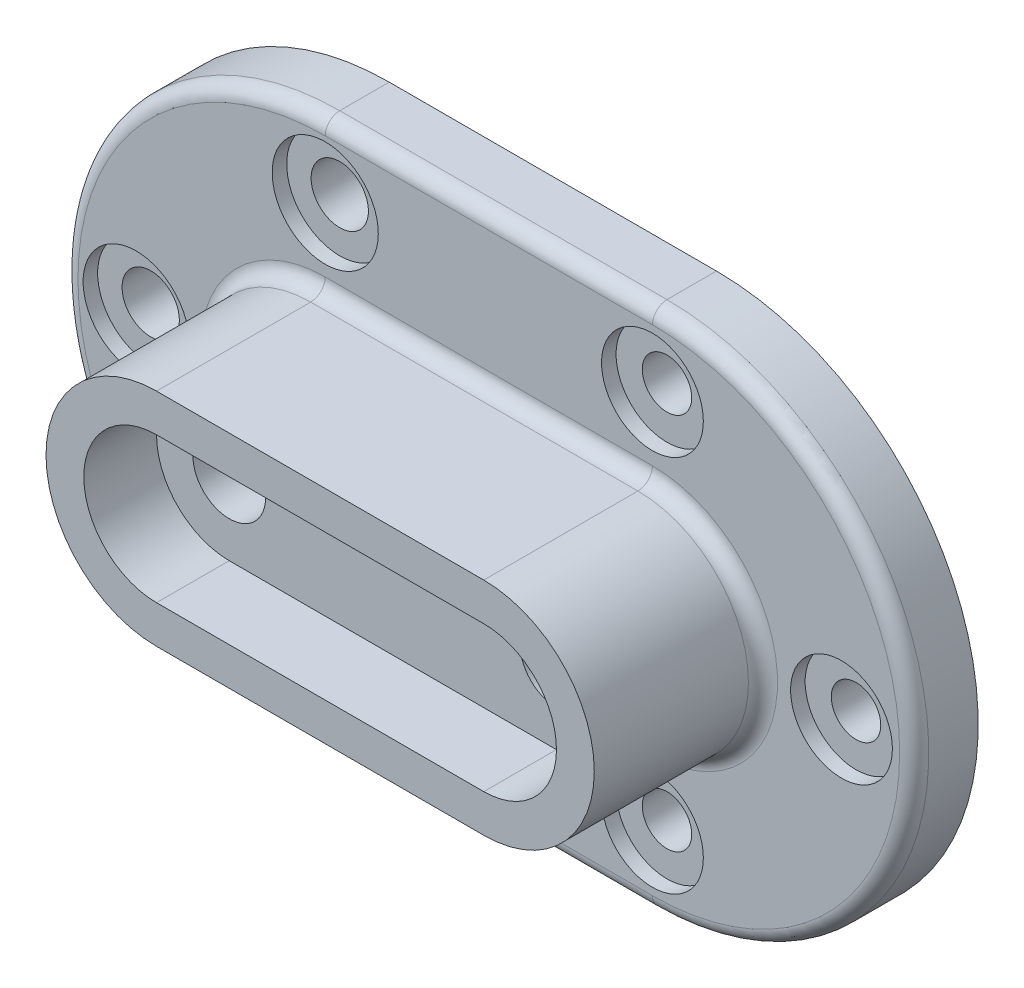
from build123d import *

# Parameters (mm, degrees)
BOSS_EXTRUDE1_DEPTH = 4.4
BOSS_EXTRUDE2_DEPTH = 16
BOSS_EXTRUDE3_DEPTH = 11
SKETCH2_R           = 2.5
CUT_EXTRUDE1_DEPTH  = 46.664537663
SKETCH3_R           = 3.5
SKETCH3_R_2         = 1.7
SKETCH3_R_3         = 3.648925592
SKETCH3_R_4         = 1.97040034
CUT_EXTRUDE2_DEPTH  = 1
SKETCH3_3_R         = 1.7
SKETCH3_3_R_2       = 1.97040034
CUT_EXTRUDE3_DEPTH  = 46.812771145
FILLET1_R           = 1


with BuildPart() as part:
    # Sketch1 → Boss-Extrude1 (new body)
    with BuildSketch(Plane.XY):
        with BuildLine():
            ThreePointArc((0, 18), (-18, 0), (0, -18))
            Line((0, -18), (22.5, -18))
            ThreePointArc((22.5, -18), (40.5, 0), (22.5, 18))
            Line((22.5, 18), (0, 18))
        make_face()
        with BuildLine():
            Line((22.5, -7.6), (0, -7.6))
            ThreePointArc((0, -7.6), (-7.6, 0), (0, 7.6))
            Line((0, 7.6), (22.5, 7.6))
            ThreePointArc((22.5, 7.6), (30.1, 0), (22.5, -7.6))
        make_face(mode=Mode.SUBTRACT)
    extrude(amount=BOSS_EXTRUDE1_DEPTH)

    # Sketch1<3> → Boss-Extrude2 (add)
    with BuildSketch(Plane.XY):
        with BuildLine():
            ThreePointArc((0, 7.6), (-7.6, 0), (0, -7.6))
            Line((0, -7.6), (22.5, -7.6))
            ThreePointArc((22.5, -7.6), (30.1, 0), (22.5, 7.6))
            Line((22.5, 7.6), (0, 7.6))
        make_face()
        with BuildLine():
            Line((22.5, -5), (0, -5))
            ThreePointArc((0, -5), (-5, 0), (0, 5))
            Line((0, 5), (22.5, 5))
            ThreePointArc((22.5, 5), (27.5, 0), (22.5, -5))
        make_face(mode=Mode.SUBTRACT)
    extrude(amount=BOSS_EXTRUDE2_DEPTH)

    # Sketch1<4> → Boss-Extrude3 (add)
    with BuildSketch(Plane.XY):
        with BuildLine():
            ThreePointArc((0, 5), (-5, 0), (0, -5))
            Line((0, -5), (22.5, -5))
            ThreePointArc((22.5, -5), (27.5, 0), (22.5, 5))
            Line((22.5, 5), (0, 5))
        make_face()
    extrude(amount=BOSS_EXTRUDE3_DEPTH)

    # Sketch2 → Cut-Extrude1 (cut, through all)
    with BuildSketch(Plane.XY.offset(11)):
        Circle(SKETCH2_R)
        with Locations((22.5, 0)):
            Circle(SKETCH2_R)
    extrude(amount=-CUT_EXTRUDE1_DEPTH, mode=Mode.SUBTRACT)

    # Sketch3 → Cut-Extrude2 (cut)
    # profile 1 of 6: a face of its own
    with BuildSketch(Plane.XY.offset(4.4)):
        with Locations((35.5, 0)):
            Circle(SKETCH3_R)
        with Locations((35.5, 0)):
            Circle(SKETCH3_R_2, mode=Mode.SUBTRACT)
    # profile 2 of 6: a face of its own
    with BuildSketch(Plane.XY.offset(4.4)):
        with Locations((-13, 0)):
            Circle(SKETCH3_R_3)
        with Locations((-13, 0)):
            Circle(SKETCH3_R_4, mode=Mode.SUBTRACT)
    # profile 3 of 6: a face of its own
    with BuildSketch(Plane.XY.offset(4.4)):
        with Locations((22.5, -13)):
            Circle(SKETCH3_R)
        with Locations((22.5, -13)):
            Circle(SKETCH3_R_2, mode=Mode.SUBTRACT)
    # profile 4 of 6: a face of its own
    with BuildSketch(Plane.XY.offset(4.4)):
        with Locations((0, 13)):
            Circle(SKETCH3_R_3)
        with Locations((0, 13)):
            Circle(SKETCH3_R_4, mode=Mode.SUBTRACT)
    # profile 5 of 6: a face of its own
    with BuildSketch(Plane.XY.offset(4.4)):
        with Locations((0, -13)):
            Circle(SKETCH3_R_3)
        with Locations((0, -13)):
            Circle(SKETCH3_R_4, mode=Mode.SUBTRACT)
    # profile 6 of 6: a face of its own
    with BuildSketch(Plane.XY.offset(4.4)):
        with Locations((22.5, 13)):
            Circle(SKETCH3_R)
        with Locations((22.5, 13)):
            Circle(SKETCH3_R_2, mode=Mode.SUBTRACT)
    extrude(amount=-CUT_EXTRUDE2_DEPTH, mode=Mode.SUBTRACT)

    # Sketch3<3> → Cut-Extrude3 (cut, through all)
    with BuildSketch(Plane.XY.offset(4.4)):
        with Locations((35.5, 0)):
            Circle(SKETCH3_3_R)
        with Locations((-13, 0)):
            Circle(SKETCH3_3_R_2)
        with Locations((22.5, -13)):
            Circle(SKETCH3_3_R)
        with Locations((0, 13)):
            Circle(SKETCH3_3_R_2)
        with Locations((0, -13)):
            Circle(SKETCH3_3_R_2)
        with Locations((22.5, 13)):
            Circle(SKETCH3_3_R)
    extrude(amount=-CUT_EXTRUDE3_DEPTH, mode=Mode.SUBTRACT)

    # Fillet1
    fillet1_edges = [part.edges().sort_by_distance(p)[0] for p in [
        (11.25, -18, 4.4),
        (-18, 0, 4.4),
        (11.25, 18, 4.4),
        (-7.6, 0, 4.4),
        (11.25, 7.6, 4.4),
        (30.1, 0, 4.4),
        (40.5, 0, 4.4),
        (11.25, -7.6, 4.4),
    ]]
    fillet(fillet1_edges, radius=FILLET1_R)


solid = part.part
